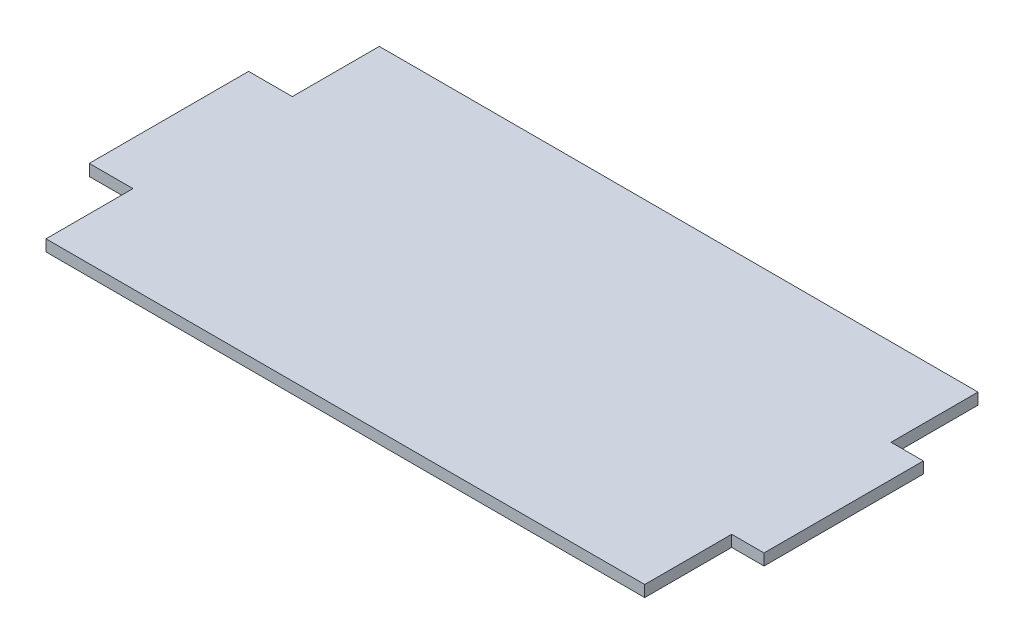
from build123d import *

# Parameters (mm, degrees)
SKIZZE1_W                       = 19.2
SKIZZE1_H                       = 70
SKIZZE1_W_2                     = 263
SKIZZE1_H_2                     = 146.4
SKIZZE1_W_3                     = 14.2
AUFSATZ_LINEAR_AUSTRAGEN1_DEPTH = 5


with BuildPart() as part:
    # Skizze1 → Aufsatz-Linear austragen1 (new body)
    with BuildSketch(Plane(origin=(0, 15, 0), x_dir=(1, 0, 0), z_dir=(0, 1, 0))):
        with Locations((-138.6, 0)):
            Rectangle(SKIZZE1_W, SKIZZE1_H)
        with Locations((2.5, 0)):
            Rectangle(SKIZZE1_W_2, SKIZZE1_H_2)
        with Locations((141.1, 0)):
            Rectangle(SKIZZE1_W_3, SKIZZE1_H)
    extrude(amount=AUFSATZ_LINEAR_AUSTRAGEN1_DEPTH)


solid = part.part
